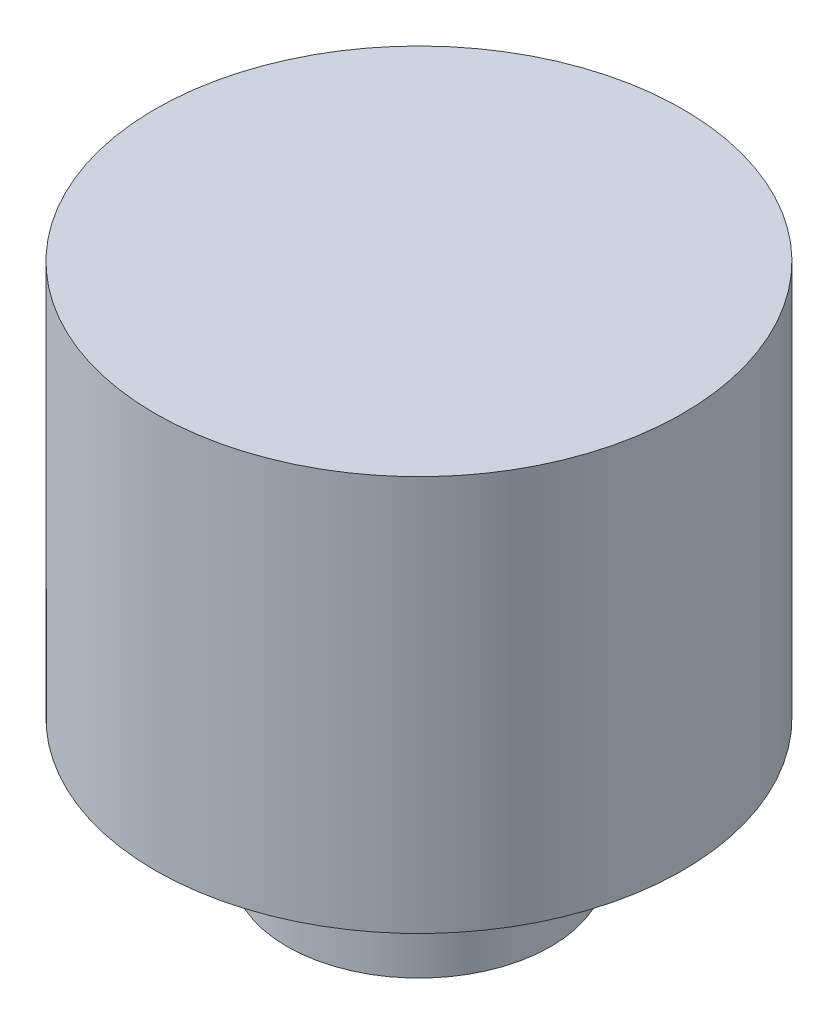
from build123d import *

# Parameters (mm, degrees)
SKETCH1_R           = 1
BOSS_EXTRUDE1_DEPTH = 1
SKETCH2_R           = 2
BOSS_EXTRUDE2_DEPTH = 3


with BuildPart() as part:
    # Sketch1 → Boss-Extrude1 (new body)
    with BuildSketch(Plane(origin=(0, 0, 0), x_dir=(1, 0, 0), z_dir=(0, 1, 0))):
        with Locations(Location((0, 0, 0), (0, 0, 270))):
            Circle(SKETCH1_R)
    extrude(amount=BOSS_EXTRUDE1_DEPTH)

    # Sketch2 → Boss-Extrude2 (add)
    with BuildSketch(Plane(origin=(0, 1, 0), x_dir=(1, 0, 0), z_dir=(0, 1, 0))):
        with Locations(Location((0, 0, 0), (0, 0, 270))):
            Circle(SKETCH2_R)
    extrude(amount=BOSS_EXTRUDE2_DEPTH)


solid = part.part
